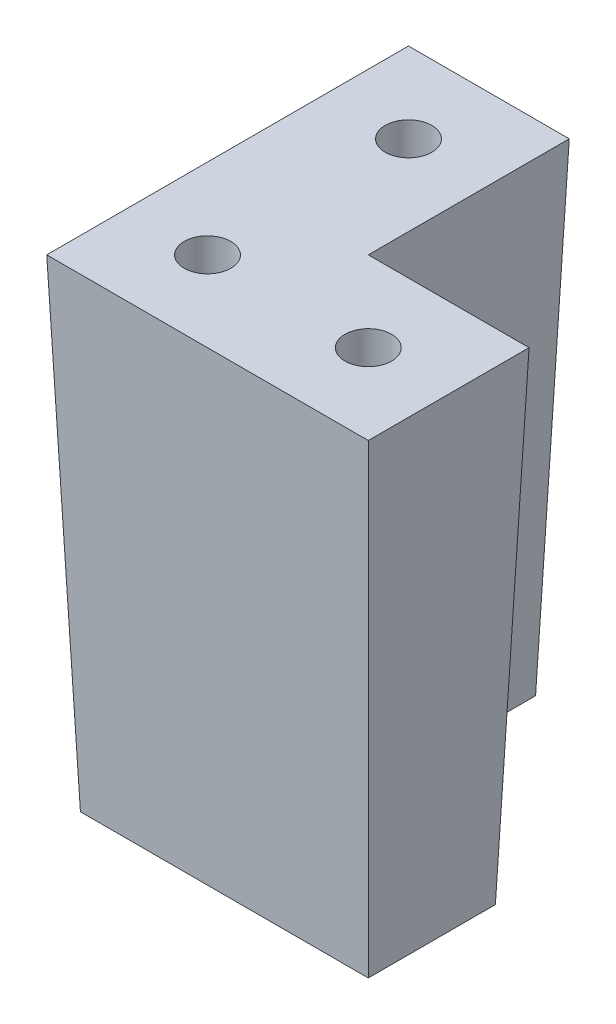
from build123d import *

# Parameters (mm, degrees)
BOSS_EXTRUDE1_DEPTH             = 60
BOSS_EXTRUDE1_DRAFT             = -2
CBORE_FOR_M5_SBHCS1_D           = 5.8
CBORE_FOR_M5_SBHCS1_CBORE_D     = 11.5
CBORE_FOR_M5_SBHCS1_CBORE_DEPTH = 55


with BuildPart() as part:
    # Sketch1 → Boss-Extrude1 (with draft: the straight prism first)
    with BuildSketch(Plane(origin=(0, 0, 0), x_dir=(1, 0, 0), z_dir=(0, 1, 0))):
        Polygon((0, 0), (40, 0), (40, 20), (20, 20), (20, 45), (0, 45), align=None)
    extrude(amount=-BOSS_EXTRUDE1_DEPTH)
    # Boss-Extrude1: the draft: its side faces are tilted about the plane it starts from
    boss_extrude1_sides = [part.faces().sort_by_distance(p)[0] for p in [
        (20, -30, 0),
        (40, -30, -10),
        (30, -30, -20),
        (20, -30, -32.5),
        (10, -30, -45),
        (0, -30, -22.5),
    ]]
    draft(boss_extrude1_sides, Plane(origin=(0, 0, 0), x_dir=(1, 0, 0), z_dir=(0, 1, 0)), BOSS_EXTRUDE1_DRAFT)

    # CBORE for M5 SBHCS1 (through all)
    with Locations(Plane(origin=(0, -60, 0), x_dir=(-1, 0, 0), z_dir=(0, -1, 0))):
        with Locations((-10, 10), (-30, 10), (-10, 35)):
            CounterBoreHole(CBORE_FOR_M5_SBHCS1_D / 2, CBORE_FOR_M5_SBHCS1_CBORE_D / 2, CBORE_FOR_M5_SBHCS1_CBORE_DEPTH)


solid = part.part
